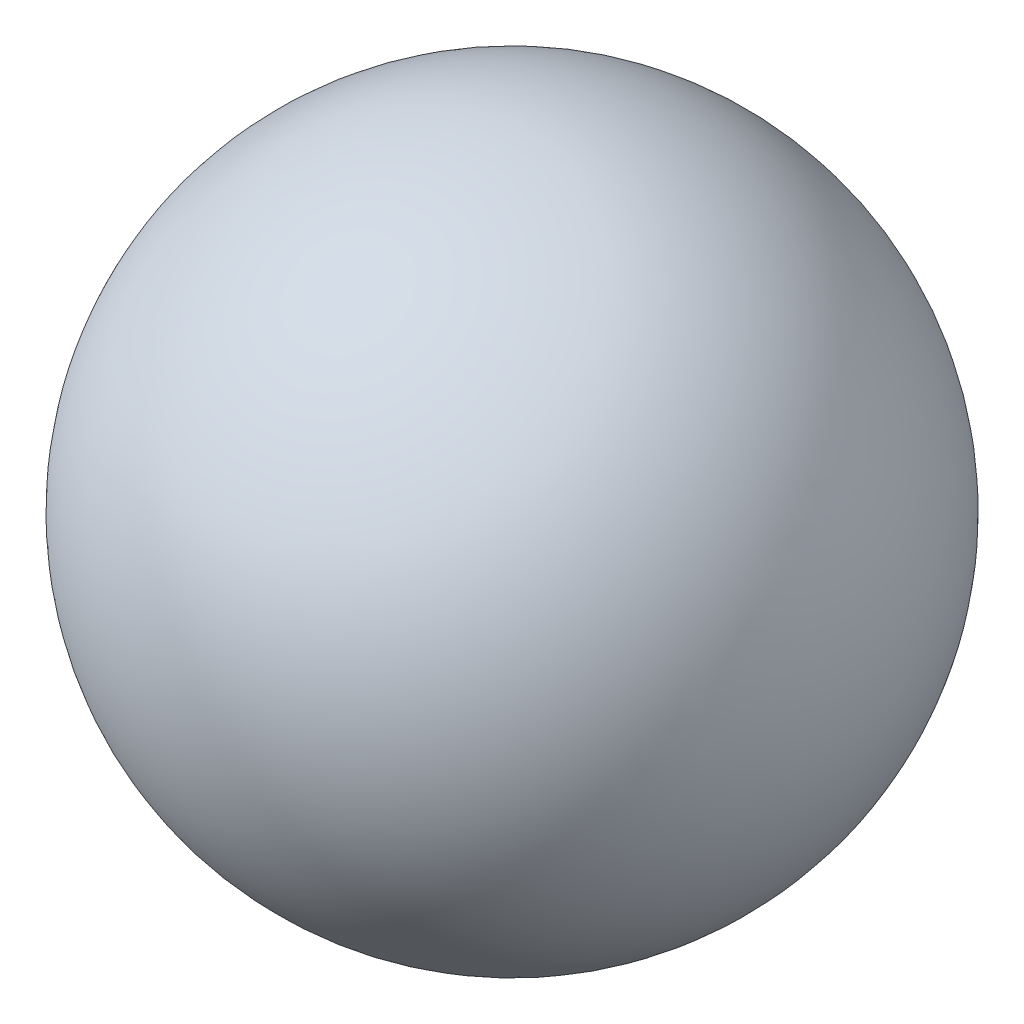
from build123d import *


with BuildPart() as part:
    # 草图1 → 旋转1 (revolve)
    with BuildSketch(Plane(origin=(0, 0, 0), x_dir=(1, 0, 0), z_dir=(0, 1, 0))):
        with BuildLine():
            Line((-31.737258329, 0), (31.737258329, 0))
            ThreePointArc((31.737258329, 0), (0, 31.737258329), (-31.737258329, 0))
        make_face()
    revolve(axis=Axis((-31.737258329, 0, 0), (1, 0, 0)))


solid = part.part
